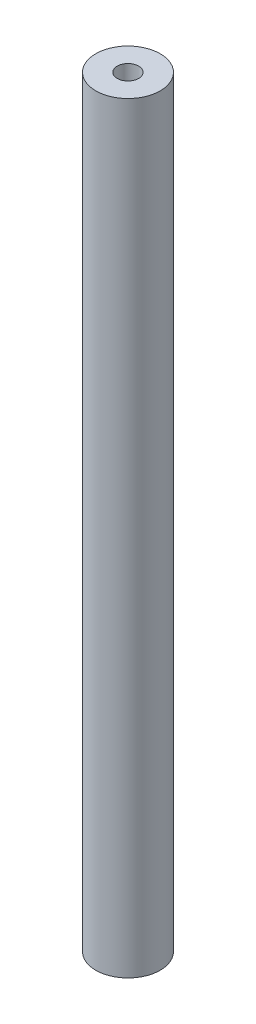
from build123d import *

# Parameters (mm, degrees)
SKETCH1_R           = 3
BOSS_EXTRUDE1_DEPTH = 71
SKETCH2_R           = 1
CUT_EXTRUDE1_DEPTH  = 3
CUT_EXTRUDE2_START  = -3
SKETCH3_R           = 1
CUT_EXTRUDE2_DEPTH  = 3


with BuildPart() as part:
    # Sketch1 → Boss-Extrude1 (new body)
    with BuildSketch(Plane(origin=(0, 0, 0), x_dir=(1, 0, 0), z_dir=(0, 1, 0))):
        with Locations(Location((0, 0, 0), (0, 0, 270))):
            Circle(SKETCH1_R)
    extrude(amount=BOSS_EXTRUDE1_DEPTH)

    # Sketch2 → Cut-Extrude1 (cut)
    with BuildSketch(Plane(origin=(0, 71, 0), x_dir=(1, 0, 0), z_dir=(0, 1, 0))):
        with Locations(Location((0, 0, 0), (0, 0, 270))):
            Circle(SKETCH2_R)
    extrude(amount=-CUT_EXTRUDE1_DEPTH, mode=Mode.SUBTRACT)

    # Sketch3 → Cut-Extrude2 (cut)
    with BuildSketch(Plane.XZ.offset(CUT_EXTRUDE2_START)):
        with Locations(Location((0, 0, 0), (0, 0, 90))):
            Circle(SKETCH3_R)
    extrude(amount=CUT_EXTRUDE2_DEPTH, mode=Mode.SUBTRACT)


solid = part.part
